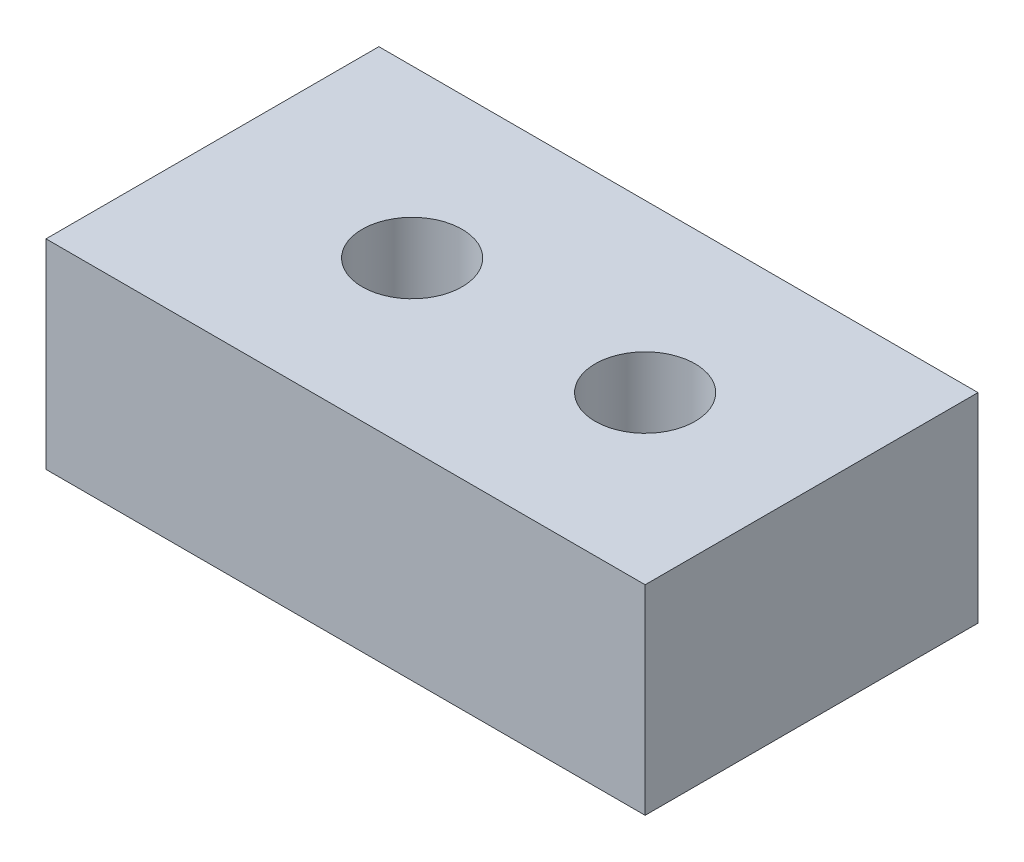
from build123d import *

# Parameters (mm, degrees)
SKETCH1_W           = 18
SKETCH1_H           = 10
BOSS_EXTRUDE1_DEPTH = 6
SKETCH2_R           = 1.5
CUT_EXTRUDE1_DEPTH  = 12.916375288


with BuildPart() as part:
    # Sketch1 → Boss-Extrude1 (new body)
    with BuildSketch(Plane(origin=(0, 0, 0), x_dir=(1, 0, 0), z_dir=(0, 1, 0))):
        Rectangle(SKETCH1_W, SKETCH1_H)
    extrude(amount=BOSS_EXTRUDE1_DEPTH)

    # Sketch2 → Cut-Extrude1 (cut, through all)
    with BuildSketch(Plane(origin=(0, 6, 0), x_dir=(1, 0, 0), z_dir=(0, 1, 0))):
        with Locations(Location((-3, 0, 0), (0, 0, 270))):
            Circle(SKETCH2_R)
        with Locations(Location((4, 0, 0), (0, 0, 270))):
            Circle(SKETCH2_R)
    extrude(amount=-CUT_EXTRUDE1_DEPTH, mode=Mode.SUBTRACT)


solid = part.part
